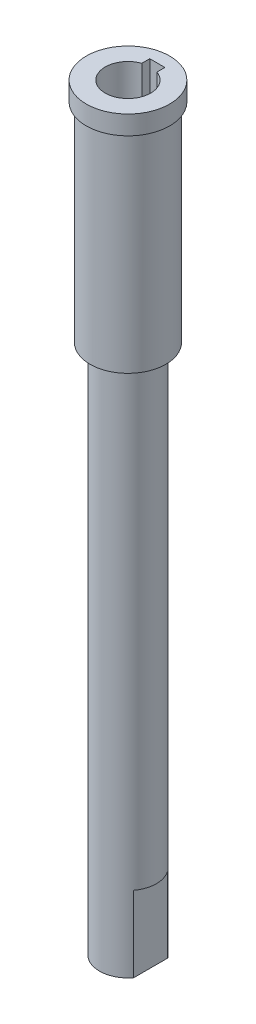
from build123d import *

# Parameters (mm, degrees)
SKETCH2_R         = 10
EXTRUDE1_DEPTH    = 200
EXTRUDE2_DEPTH    = 30
SKETCH5_OUTSIDE_W = 62.398
SKETCH5_OUTSIDE_H = 62.398
SKETCH5_OUTSIDE_R = 7.5
EXTRUDE4_DEPTH    = 140
SKETCH6_R         = 11
SKETCH6_R_2       = 8.630699516
EXTRUDE5_DEPTH    = 5
SKETCH7_W         = 11.867066039
SKETCH7_H         = 33.623353778
EXTRUDE6_DEPTH    = 20


with BuildPart() as part:
    # Sketch2 → Extrude1 (new body)
    with BuildSketch(Plane(origin=(0, 0, 0), x_dir=(1, 0, 0), z_dir=(0, 1, 0))):
        with Locations(Location((0, 0, 0), (0, 0, 270))):
            Circle(SKETCH2_R)
    extrude(amount=EXTRUDE1_DEPTH)

    # Sketch3 → Extrude2 (cut)
    with BuildSketch(Plane(origin=(0, 200, 0), x_dir=(1, 0, 0), z_dir=(0, 1, 0))):
        with BuildLine():
            Line((2, 5.656854249), (2, 7.749317393))
            Line((2, 7.749317393), (-2, 7.749317393))
            Line((-2, 7.749317393), (-2, 5.656854249))
            ThreePointArc((-2, 5.656854249), (0, -6), (2, 5.656854249))
        make_face()
    extrude(amount=-EXTRUDE2_DEPTH, mode=Mode.SUBTRACT)

    # Sketch5 outside → Extrude4 (cut)
    with BuildSketch(Plane.XZ):
        Rectangle(SKETCH5_OUTSIDE_W, SKETCH5_OUTSIDE_H)
        with Locations(Location((0, 0, 0), (0, 0, 270))):
            Circle(SKETCH5_OUTSIDE_R, mode=Mode.SUBTRACT)
    extrude(amount=-EXTRUDE4_DEPTH, mode=Mode.SUBTRACT)

    # Sketch6 → Extrude5 (add)
    with BuildSketch(Plane(origin=(0, 200, 0), x_dir=(1, 0, 0), z_dir=(0, 1, 0))):
        with Locations(Location((0, 0, 0), (0, 0, 270))):
            Circle(SKETCH6_R)
        Circle(SKETCH6_R_2, mode=Mode.SUBTRACT)
    extrude(amount=-EXTRUDE5_DEPTH)

    # Sketch7 → Extrude6 (cut)
    with BuildSketch(Plane.XZ):
        with Locations((11.93353302, 6.659772738)):
            Rectangle(SKETCH7_W, SKETCH7_H)
    extrude(amount=-EXTRUDE6_DEPTH, mode=Mode.SUBTRACT)


solid = part.part
